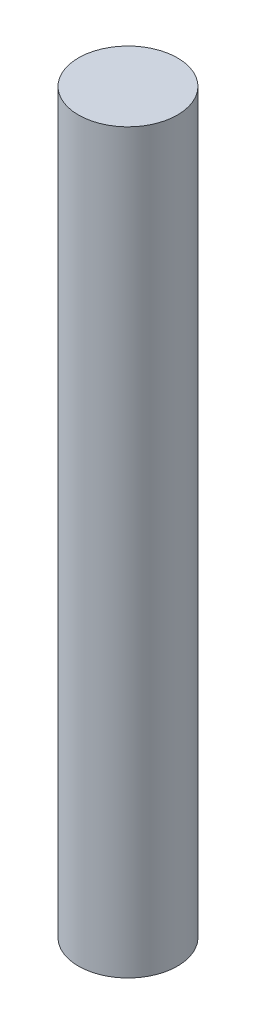
from build123d import *

# Parameters (mm, degrees)
SKETCH1_R           = 4.5
BOSS_EXTRUDE1_DEPTH = 67


with BuildPart() as part:
    # Sketch1 → Boss-Extrude1 (new body)
    with BuildSketch(Plane(origin=(0, 0, 0), x_dir=(1, 0, 0), z_dir=(0, 1, 0))):
        with Locations(Location((-36.326165657, 11.346130256, 0), (0, 0, 270))):
            Circle(SKETCH1_R)
    extrude(amount=BOSS_EXTRUDE1_DEPTH)


solid = part.part
